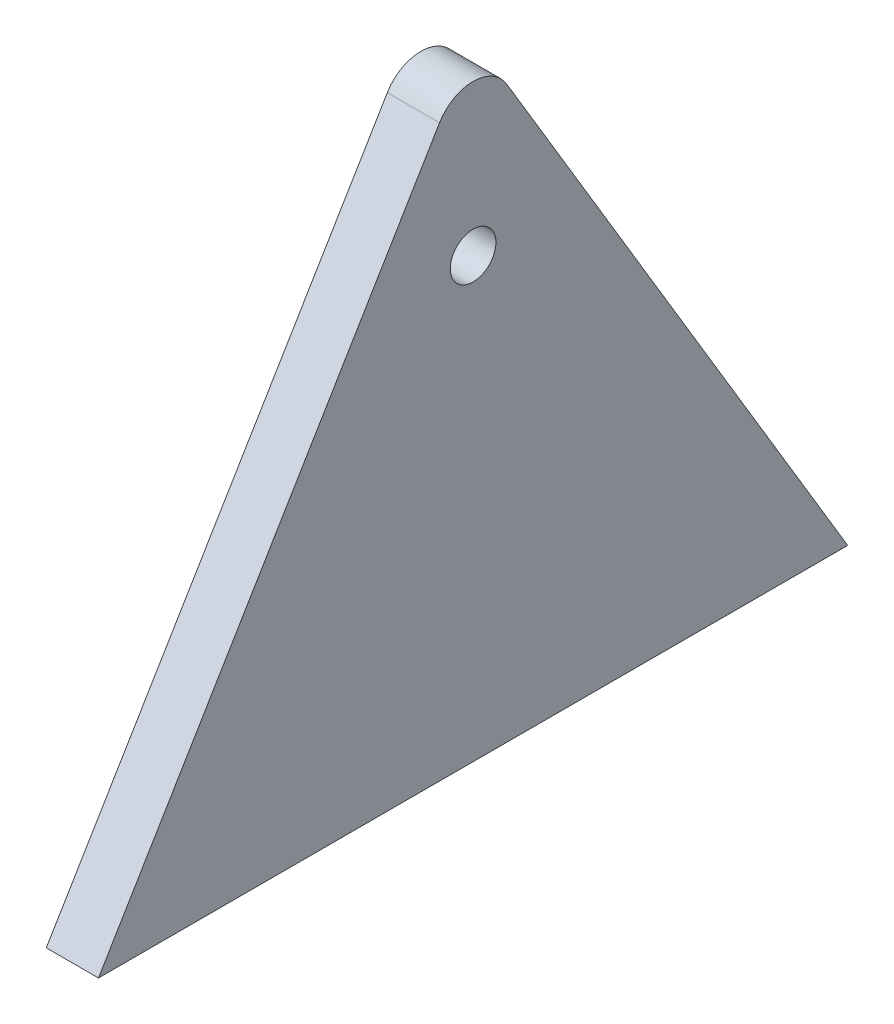
from build123d import *

# Parameters (mm, degrees)
BOSS_EXTRUDE1_DEPTH     = 12.7
FILLET1_R               = 9.525
CUT_EXTRUDE3_DEPTH      = 171.371755619
CUT_EXTRUDE3_DEPTH_BACK = 171.371755619
SKETCH2_R               = 5.55625


with BuildPart() as part:
    # Sketch1 → Boss-Extrude1 (new body)
    with BuildSketch(Plane(origin=(0, 0, 0), x_dir=(0, 0, -1), z_dir=(1, 0, 0))):
        Polygon((0, 152.4), (-91.160761442, 0), (91.160761442, 0), align=None)
    extrude(amount=BOSS_EXTRUDE1_DEPTH)

    # Fillet1
    fillet1_edges = [part.edges().sort_by_distance(p)[0] for p in [
        (6.35, 152.4, 0),
    ]]
    fillet(fillet1_edges, radius=FILLET1_R)

    # Sketch2 → Cut-Extrude3 (cut, two sides: drawn at the far end of the back side and taken through both)
    with BuildSketch(Plane(origin=(0, 0, 0), x_dir=(0, 0, -1), z_dir=(1, 0, 0)).offset(-CUT_EXTRUDE3_DEPTH_BACK)):
        with Locations((0, 106.68)):
            Circle(SKETCH2_R)
    extrude(amount=CUT_EXTRUDE3_DEPTH + CUT_EXTRUDE3_DEPTH_BACK, mode=Mode.SUBTRACT)


solid = part.part
